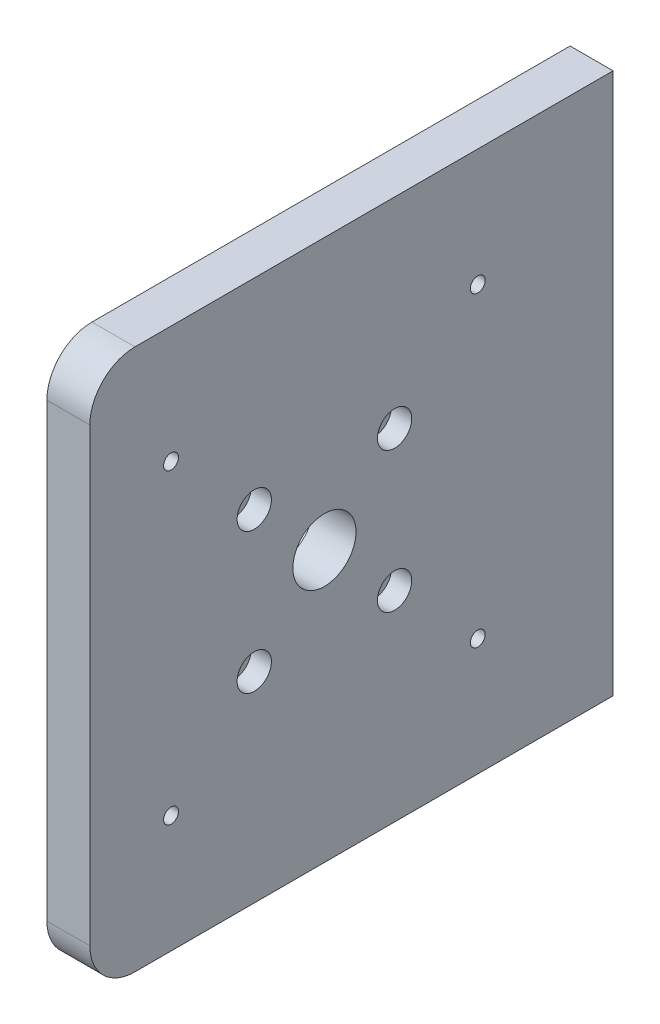
from build123d import *

# Parameters (mm, degrees)
SKETCH1_W                                    = 120
SKETCH1_H                                    = 116
BOSS_EXTRUDE1_DEPTH                          = 9.525
CBORE_FOR_M4_HEX_HEAD_CAP_SCREW1_D           = 4.2
CBORE_FOR_M4_HEX_HEAD_CAP_SCREW1_CBORE_D     = 7.6
CBORE_FOR_M4_HEX_HEAD_CAP_SCREW1_CBORE_DEPTH = 4.5
SKETCH2_R                                    = 7
CUT_EXTRUDE1_DEPTH                           = 84.992414092
SKETCH5_R                                    = 1.65
CUT_EXTRUDE2_DEPTH                           = 10
SKETCH6_R                                    = 1.65
CUT_EXTRUDE3_DEPTH                           = 84.992414092
FILLET1_R                                    = 10


with BuildPart() as part:
    # Sketch1 → Boss-Extrude1 (new body)
    with BuildSketch(Plane.YZ):
        Rectangle(SKETCH1_W, SKETCH1_H)
    extrude(amount=BOSS_EXTRUDE1_DEPTH)

    # CBORE for M4 Hex Head Cap Screw1 (through all)
    with Locations(Plane(origin=(9.525, -15.556349186, 21.556349186), x_dir=(0, 0, 1), z_dir=(1, 0, 0))):
        with Locations((0, 0), (0, -31.112698372), (-31.112698372, -31.112698372), (-31.112698372, 0)):
            CounterBoreHole(CBORE_FOR_M4_HEX_HEAD_CAP_SCREW1_D / 2, CBORE_FOR_M4_HEX_HEAD_CAP_SCREW1_CBORE_D / 2, CBORE_FOR_M4_HEX_HEAD_CAP_SCREW1_CBORE_DEPTH)

    # Sketch2 → Cut-Extrude1 (cut, through all)
    with BuildSketch(Plane.YZ.offset(9.525)):
        with Locations(Location((0, 6, 0), (0, 0, 270))):
            Circle(SKETCH2_R)
    extrude(amount=-CUT_EXTRUDE1_DEPTH, mode=Mode.SUBTRACT)

    # Sketch5 → Cut-Extrude2 (cut)
    with BuildSketch(Plane(origin=(0, 0, -58), x_dir=(1, 0, 0), z_dir=(0, 0, -1))):
        with Locations(Location((4.7625, 27, 0), (0, 0, 180))):
            Circle(SKETCH5_R)
        with Locations(Location((4.7625, 0, 0), (0, 0, 180))):
            Circle(SKETCH5_R)
        with Locations(Location((4.7625, -27, 0), (0, 0, 180))):
            Circle(SKETCH5_R)
        with Locations(Location((4.7625, -54, 0), (0, 0, 180))):
            Circle(SKETCH5_R)
        with Locations(Location((4.7625, 54, 0), (0, 0, 180))):
            Circle(SKETCH5_R)
    extrude(amount=-CUT_EXTRUDE2_DEPTH, mode=Mode.SUBTRACT)

    # Sketch6 → Cut-Extrude3 (cut, through all)
    with BuildSketch(Plane.YZ.offset(9.525)):
        with Locations(Location((34, 40, 0), (0, 0, 270))):
            Circle(SKETCH6_R)
        with Locations(Location((34, -28, 0), (0, 0, 270))):
            Circle(SKETCH6_R)
        with Locations(Location((-34, -28, 0), (0, 0, 270))):
            Circle(SKETCH6_R)
        with Locations(Location((-34, 40, 0), (0, 0, 270))):
            Circle(SKETCH6_R)
    extrude(amount=-CUT_EXTRUDE3_DEPTH, mode=Mode.SUBTRACT)

    # Fillet1
    fillet1_edges = [part.edges().sort_by_distance(p)[0] for p in [
        (4.7625, -60, 58),
        (4.7625, 60, 58),
    ]]
    fillet(fillet1_edges, radius=FILLET1_R)


solid = part.part
